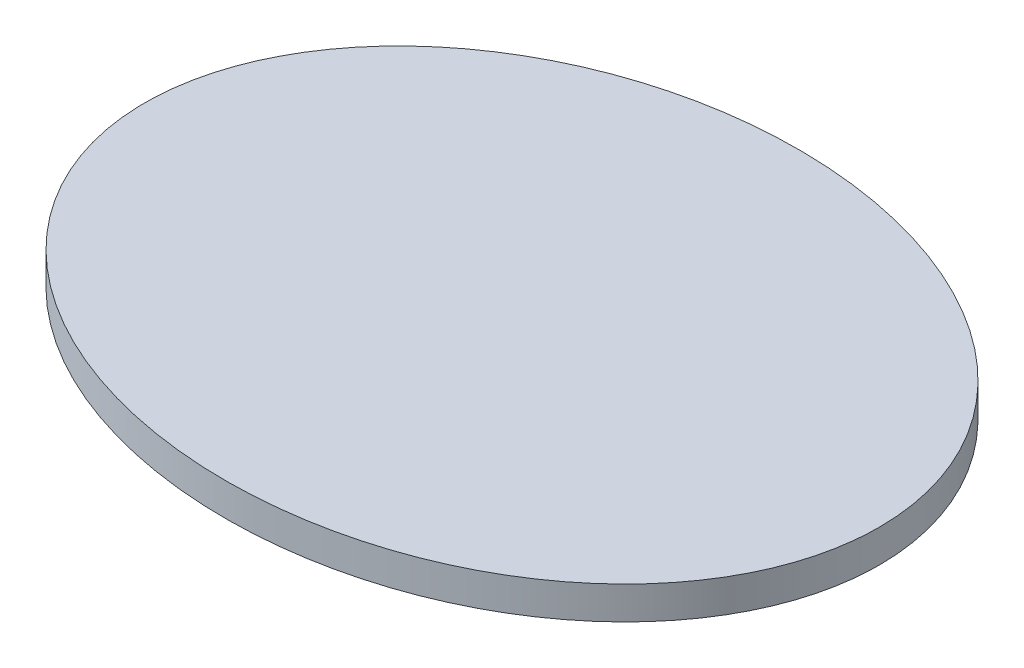
from build123d import *

# Parameters (mm, degrees)
SKETCH12_RX         = 71.055615084
SKETCH12_RY         = 55.44491177
BOSS_EXTRUDE3_DEPTH = 3.175


with BuildPart() as part:
    # Sketch12 → Boss-Extrude3 (new, symmetric)
    with BuildSketch(Plane(origin=(0, 0, 0), x_dir=(1, 0, 0), z_dir=(0, 1, 0))):
        with Locations((0, 0)):
            Ellipse(SKETCH12_RX, SKETCH12_RY)
    extrude(amount=BOSS_EXTRUDE3_DEPTH, both=True)


solid = part.part
